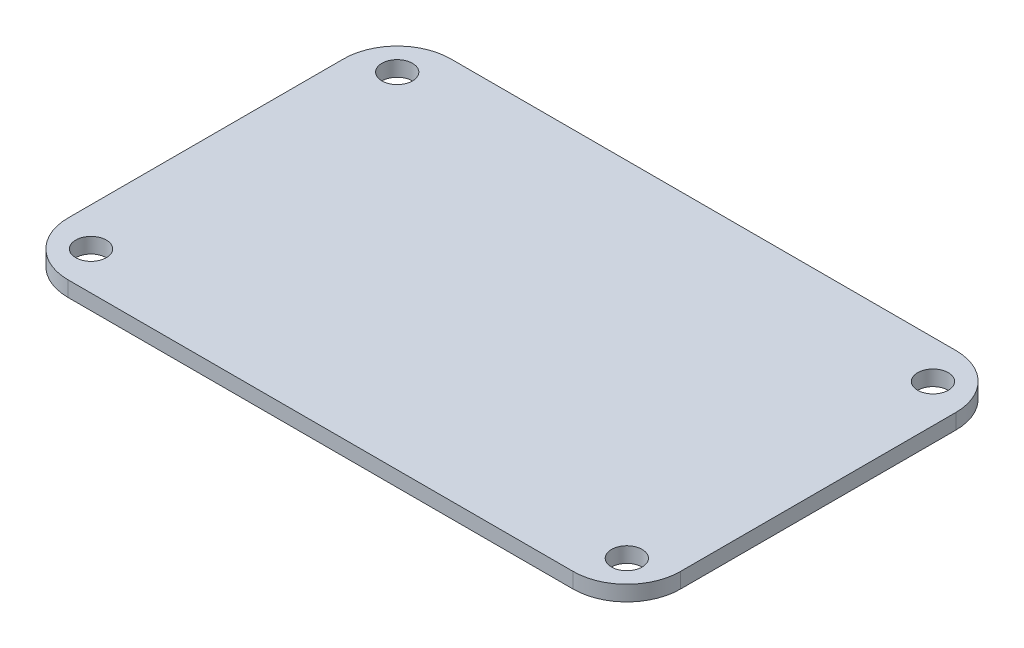
from build123d import *

# Parameters (mm, degrees)
SKETCH_LID_W                 = 80
SKETCH_LID_H                 = 50
BOSS_EXTRUDE_LID_DEPTH       = 2
FILLET_CORNERS_R             = 7
SKETCH_SCREW_HOLE_R          = 2
CUT_EXTRUDE_SCREW_HOLE_DEPTH = 2


with BuildPart() as part:
    # Sketch_lid → Boss-Extrude_lid (new body)
    with BuildSketch(Plane(origin=(0, 0, 0), x_dir=(1, 0, 0), z_dir=(0, 1, 0))):
        Rectangle(SKETCH_LID_W, SKETCH_LID_H)
    extrude(amount=BOSS_EXTRUDE_LID_DEPTH)

    # Fillet_corners
    fillet_corners_edges = [part.edges().sort_by_distance(p)[0] for p in [
        (40, 1, 25),
        (-40, 1, 25),
        (-40, 1, -25),
        (40, 1, -25),
    ]]
    fillet(fillet_corners_edges, radius=FILLET_CORNERS_R)

    # Sketch_screw_hole → Cut-Extrude_screw_hole (cut)
    with BuildSketch(Plane.XZ):
        with Locations(Location((-35, -20, 0), (0, 0, 270))):
            Circle(SKETCH_SCREW_HOLE_R)
        with Locations(Location((35, -20, 0), (0, 0, 270))):
            Circle(SKETCH_SCREW_HOLE_R)
        with Locations(Location((35, 20, 0), (0, 0, 270))):
            Circle(SKETCH_SCREW_HOLE_R)
        with Locations(Location((-35, 20, 0), (0, 0, 270))):
            Circle(SKETCH_SCREW_HOLE_R)
    extrude(amount=-CUT_EXTRUDE_SCREW_HOLE_DEPTH, mode=Mode.SUBTRACT)


solid = part.part
